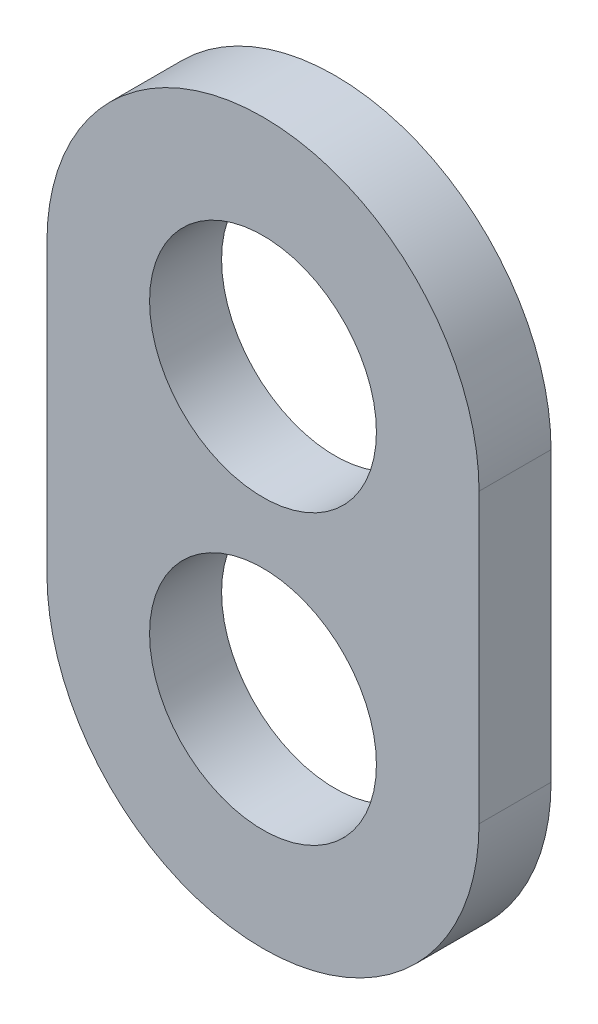
from build123d import *

# Parameters (mm, degrees)
SKETCH1_R           = 3.15
BOSS_EXTRUDE1_DEPTH = 2


with BuildPart() as part:
    # Sketch1 → Boss-Extrude1 (new body)
    with BuildSketch(Plane.XY):
        with BuildLine():
            Line((6, 4), (6, -4))
            ThreePointArc((6, -4), (0, -10), (-6, -4))
            Line((-6, -4), (-6, 4))
            ThreePointArc((-6, 4), (0, 10), (6, 4))
        make_face()
        with Locations((0, 4)):
            Circle(SKETCH1_R, mode=Mode.SUBTRACT)
        with Locations(Location((0, -4, 0), (0, 0, 180))):
            Circle(SKETCH1_R, mode=Mode.SUBTRACT)
    extrude(amount=BOSS_EXTRUDE1_DEPTH)


solid = part.part
